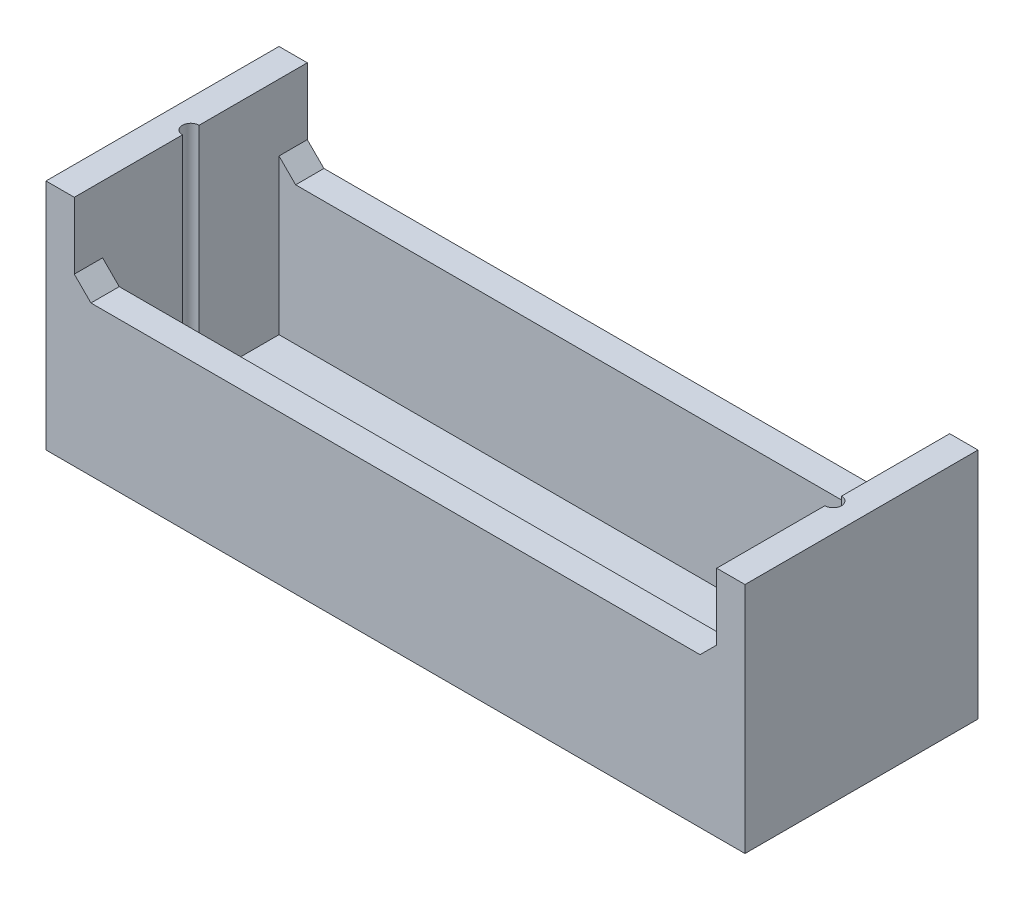
from build123d import *

# Parameters (mm, degrees)
SKETCH1_W           = 42
SKETCH1_H           = 14
BOSS_EXTRUDE1_DEPTH = 10
SHELL1_T            = -1.7
SKETCH2_W           = 1.7
SKETCH2_H           = 14
BOSS_EXTRUDE2_DEPTH = 5
SKETCH3_R           = 0.5
CUT_EXTRUDE1_DEPTH  = 13.3
CHAMFER1_SIZE       = 1
CHAMFER2_SIZE       = 1


with BuildPart() as part:
    # Sketch1 → Boss-Extrude1 (new body)
    with BuildSketch(Plane(origin=(0, 0, 0), x_dir=(1, 0, 0), z_dir=(0, 1, 0))):
        with Locations((19, 5)):
            Rectangle(SKETCH1_W, SKETCH1_H)
    extrude(amount=BOSS_EXTRUDE1_DEPTH)

    # Shell1
    shell1_openings = [part.faces().sort_by_distance(p)[0] for p in [
        (19, 10, -5),
    ]]
    offset(amount=SHELL1_T, openings=shell1_openings, kind=Kind.INTERSECTION)

    # Sketch2 → Boss-Extrude2 (add)
    with BuildSketch(Plane(origin=(0, 10, 0), x_dir=(1, 0, 0), z_dir=(0, 1, 0))):
        with Locations((-1.15, 5)):
            Rectangle(SKETCH2_W, SKETCH2_H)
        with Locations((39.15, 5)):
            Rectangle(SKETCH2_W, SKETCH2_H)
    extrude(amount=BOSS_EXTRUDE2_DEPTH)

    # Sketch3 → Cut-Extrude1 (cut)
    with BuildSketch(Plane(origin=(0, 15, 0), x_dir=(1, 0, 0), z_dir=(0, 1, 0))):
        with Locations((-0.3, 5)):
            Circle(SKETCH3_R)
        with Locations((38.3, 5)):
            Circle(SKETCH3_R)
    extrude(amount=-CUT_EXTRUDE1_DEPTH, mode=Mode.SUBTRACT)

    # Chamfer1
    chamfer1_edges = [part.edges().sort_by_distance(p)[0] for p in [
        (-0.3, 10, -11.15),
        (-0.3, 10, 1.15),
        (38.3, 10, -11.15),
        (38.3, 10, 1.15),
    ]]
    chamfer(chamfer1_edges, length=CHAMFER1_SIZE)

    # Chamfer2
    chamfer2_edges = [part.edges().sort_by_distance(p)[0] for p in [
        (19, 0, -12),
        (40, 0, -5),
        (19, 0, 2),
        (-2, 0, -5),
    ]]
    chamfer(chamfer2_edges, length=CHAMFER2_SIZE)


solid = part.part
